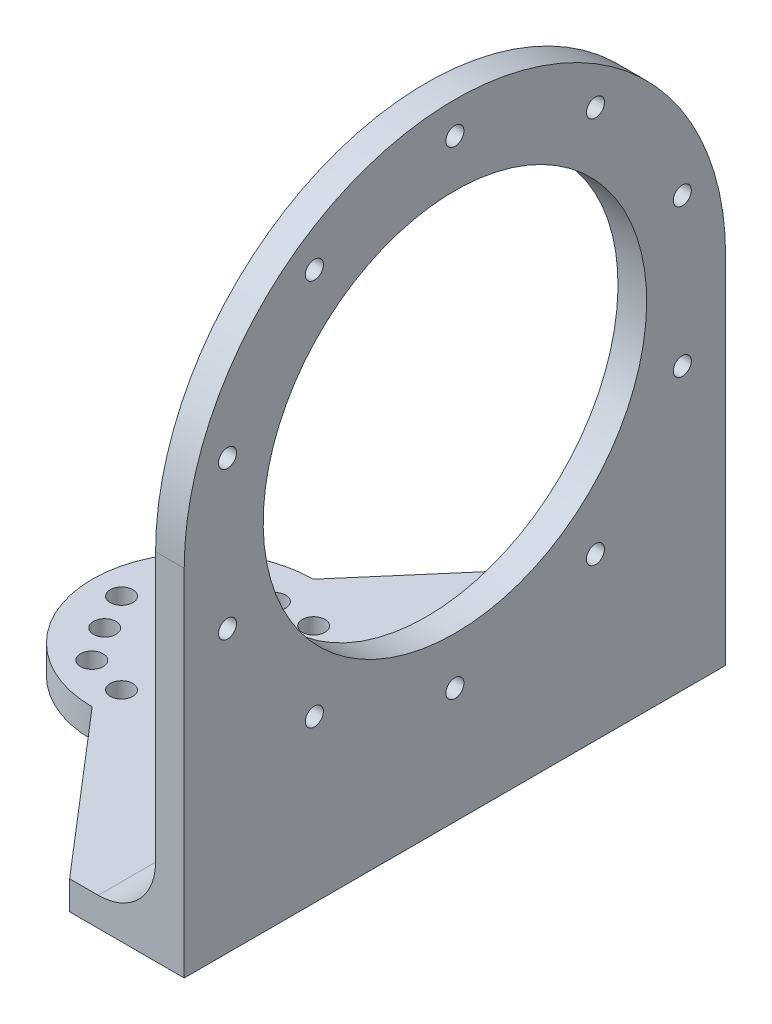
from build123d import *

# Parameters (mm, degrees)
BOSS_EXTRUDE1_DEPTH = 120
CUT_EXTRUDE1_DEPTH  = 6.35
SKETCH4_R           = 2.5
CUT_EXTRUDE2_DEPTH  = 6.35
SKETCH5_R           = 2
SKETCH5_R_2         = 42.5
CUT_EXTRUDE4_DEPTH  = 6.35
CUT_EXTRUDE8_DEPTH  = 6.35


with BuildPart() as part:
    # Sketch2 → Boss-Extrude1 (new body)
    with BuildSketch(Plane.XY):
        with BuildLine():
            Line((-50.8, -76.2), (50.8, -76.2))
            Line((50.8, -76.2), (50.8, 76.2))
            Line((50.8, 76.2), (47.625, 76.2))
            ThreePointArc((47.625, 76.2), (45.37993597, 75.27006403), (44.45, 73.025))
            Line((44.45, 73.025), (44.45, -57.15))
            ThreePointArc((44.45, -57.15), (40.730256121, -66.130256121), (31.75, -69.85))
            Line((31.75, -69.85), (-47.625, -69.85))
            ThreePointArc((-47.625, -69.85), (-49.87006403, -70.77993597), (-50.8, -73.025))
            Line((-50.8, -73.025), (-50.8, -76.2))
        make_face()
    extrude(amount=BOSS_EXTRUDE1_DEPTH)

    # Sketch3 → Cut-Extrude1 (cut)
    with BuildSketch(Plane(origin=(0, -69.85, 0), x_dir=(1, 0, 0), z_dir=(0, 1, 0))):
        with BuildLine():
            Line((-5.1, -35.5), (25.4, 0))
            Line((25.4, 0), (-50.8, 0))
            Line((-50.8, 0), (-50.8, -120))
            Line((-50.8, -120), (25.4, -120))
            Line((25.4, -120), (-5.1, -84.5))
            ThreePointArc((-5.1, -84.5), (-29.6, -60), (-5.1, -35.5))
        make_face()
    extrude(amount=-CUT_EXTRUDE1_DEPTH, mode=Mode.SUBTRACT)

    # Sketch4 → Cut-Extrude2 (cut)
    with BuildSketch(Plane(origin=(0, -69.85, 0), x_dir=(1, 0, 0), z_dir=(0, 1, 0))):
        with Locations(Location((-5.1, -44.1, 0), (0, 0, 180))):
            Circle(SKETCH4_R)
        with Locations(Location((8.66980392, -67.95, 0), (0, 0, 180))):
            Circle(SKETCH4_R)
        with Locations(Location((-18.86980392, -67.95, 0), (0, 0, 180))):
            Circle(SKETCH4_R)
        with Locations(Location((3.9, -44.411542732, 0), (0, 0, 180))):
            Circle(SKETCH4_R)
        with Locations(Location((10.488457268, -51, 0), (0, 0, 180))):
            Circle(SKETCH4_R)
        with Locations(Location((12.9, -60, 0), (0, 0, 180))):
            Circle(SKETCH4_R)
        with Locations(Location((3.9, -75.588457268, 0), (0, 0, 180))):
            Circle(SKETCH4_R)
        with Locations(Location((-5.1, -78, 0), (0, 0, 180))):
            Circle(SKETCH4_R)
        with Locations(Location((-14.1, -75.588457268, 0), (0, 0, 180))):
            Circle(SKETCH4_R)
        with Locations(Location((-23.1, -60, 0), (0, 0, 180))):
            Circle(SKETCH4_R)
        with Locations(Location((-20.688457268, -51, 0), (0, 0, 180))):
            Circle(SKETCH4_R)
        with Locations(Location((-14.1, -44.411542732, 0), (0, 0, 180))):
            Circle(SKETCH4_R)
    extrude(amount=-CUT_EXTRUDE2_DEPTH, mode=Mode.SUBTRACT)

    # Sketch5 → Cut-Extrude4 (cut)
    with BuildSketch(Plane.ZY.offset(-44.45)):
        with Locations(Location((60, 55.45, 0), (0, 0, 270))):
            Circle(SKETCH5_R)
        with Locations(Location((91.152618372, 45.327900702, 0), (0, 0, 270))):
            Circle(SKETCH5_R)
        with Locations(Location((110.405995364, 18.827900702, 0), (0, 0, 270))):
            Circle(SKETCH5_R)
        with Locations(Location((110.405995364, -13.927900702, 0), (0, 0, 270))):
            Circle(SKETCH5_R)
        with Locations(Location((91.152618372, -40.427900702, 0), (0, 0, 270))):
            Circle(SKETCH5_R)
        with Locations(Location((60, -50.55, 0), (0, 0, 270))):
            Circle(SKETCH5_R)
        with Locations(Location((28.847381629, -40.427900702, 0), (0, 0, 270))):
            Circle(SKETCH5_R)
        with Locations(Location((9.594004636, -13.927900702, 0), (0, 0, 270))):
            Circle(SKETCH5_R)
        with Locations(Location((9.594004636, 18.827900702, 0), (0, 0, 270))):
            Circle(SKETCH5_R)
        with Locations(Location((28.847381629, 45.327900702, 0), (0, 0, 270))):
            Circle(SKETCH5_R)
        with Locations(Location((60, 2.45, 0), (0, 0, 270))):
            Circle(SKETCH5_R_2)
    extrude(amount=-CUT_EXTRUDE4_DEPTH, mode=Mode.SUBTRACT)

    # Sketch6 → Cut-Extrude8 (cut)
    with BuildSketch(Plane.ZY.offset(-44.45)):
        with BuildLine():
            Line((0, 76.2), (0, 2.45))
            ThreePointArc((0, 2.45), (60, 62.45), (120, 2.45))
            Line((120, 2.45), (120, 76.2))
            Line((120, 76.2), (0, 76.2))
        make_face()
    extrude(amount=-CUT_EXTRUDE8_DEPTH, mode=Mode.SUBTRACT)


solid = part.part
